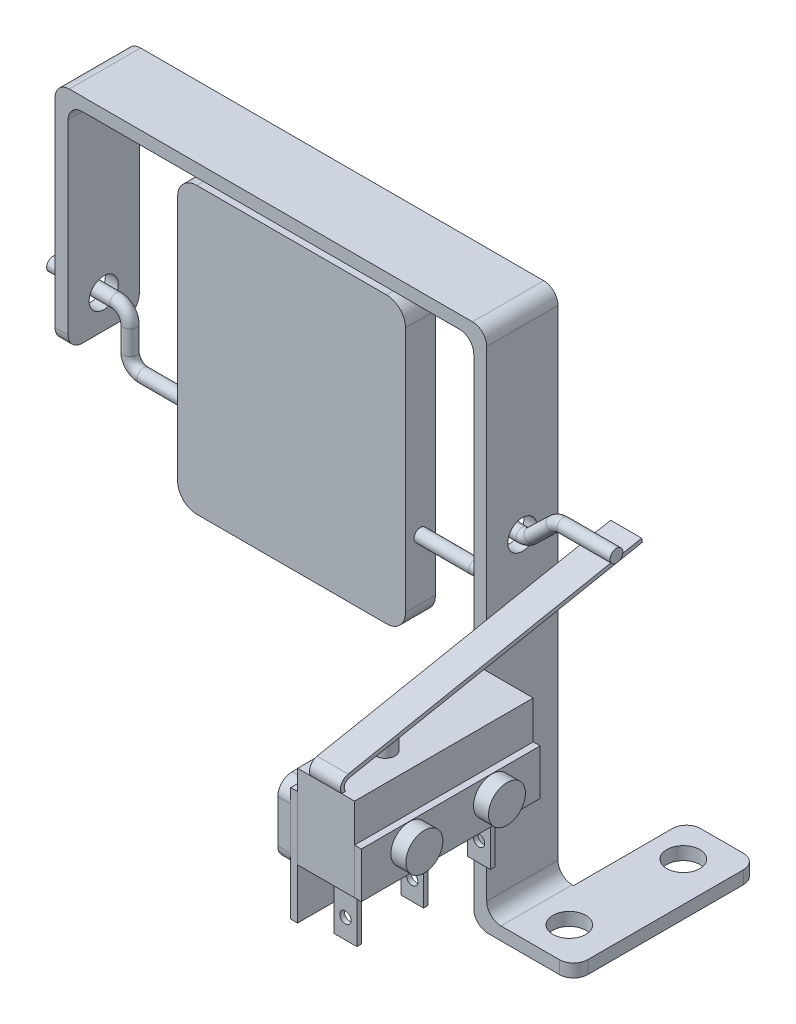
from build123d import *

# Parameters (mm, degrees)
BOSS_EXTRUDE1_DEPTH   = 3.96875
SKETCH2_W             = 7.9375
SKETCH2_H             = 12.5857
BOSS_EXTRUDE2_DEPTH   = 1.4478
SKETCH13_R            = 1.8415
CUT_EXTRUDE3_DEPTH    = 83.644481068
BOSS_EXTRUDE3_DEPTH   = 7.9375
SKETCH12_R            = 1.6256
CUT_EXTRUDE2_DEPTH    = 87.754067418
FILLET1_R             = 1.5875
SKETCH5_W             = 20.828
SKETCH5_H             = 12.7
BOSS_EXTRUDE5_DEPTH   = 0.762
SKETCH4_W             = 19.9136
SKETCH4_H             = 9.3218
BOSS_EXTRUDE4_DEPTH   = 6.35
SKETCH6_W             = 19.9136
SKETCH6_H             = 5.08
BOSS_EXTRUDE6_DEPTH   = 0.762
SKETCH7_R             = 2.06375
BOSS_EXTRUDE7_DEPTH   = 1.6637
SKETCH8_W             = 0.508
SKETCH8_H             = 6.858
BOSS_EXTRUDE8_DEPTH   = 2.54
BOSS_EXTRUDE8_2_DEPTH = 2.54
BOSS_EXTRUDE8_3_DEPTH = 2.54
SKETCH9_R             = 0.635
CUT_EXTRUDE1_DEPTH    = 93.418192325
BOSS_EXTRUDE9_DEPTH   = 1.7272
BOSS_EXTRUDE10_REACH  = 72.944
SKETCH11_R            = 1.0795
SKETCH15_R            = 0.71755
BOSS_EXTRUDE11_DEPTH  = 1.6637


with BuildPart() as part:
    # Sketch1 → Boss-Extrude1 (new, symmetric)
    with BuildSketch(Plane.XY):
        Polygon((0, 0), (-11.1252, 0), (-11.1252, 56.7182), (-56.3372, 56.7182), (-56.3372, 32.766), (-57.785, 32.766), (-57.785, 58.166), (-9.6774, 58.166), (-9.6774, 1.4478), (0, 1.4478), align=None)
    extrude(amount=BOSS_EXTRUDE1_DEPTH, both=True)

    # Sketch2 → Boss-Extrude2 (add)
    with BuildSketch(Plane(origin=(0, 1.4478, 0), x_dir=(1, 0, 0), z_dir=(0, 1, 0))):
        with Locations((-3.96875, 10.2616)):
            Rectangle(SKETCH2_W, SKETCH2_H)
    extrude(amount=-BOSS_EXTRUDE2_DEPTH)

    # Sketch13 → Cut-Extrude3 (cut, through all)
    with BuildSketch(Plane(origin=(0, 1.4478, 0), x_dir=(1, 0, 0), z_dir=(0, 1, 0))):
        with Locations(Location((-4.3815, 12.64285, 0), (0, 0, 270))):
            Circle(SKETCH13_R)
        with Locations(Location((-4.3815, -0.05715, 0), (0, 0, 270))):
            Circle(SKETCH13_R)
    extrude(amount=-CUT_EXTRUDE3_DEPTH, mode=Mode.SUBTRACT)

    # Sketch3 → Boss-Extrude3 (add)
    with BuildSketch(Plane(origin=(0, 19.5326, 0), x_dir=(1, 0, 0), z_dir=(0, 1, 0))):
        Polygon((-9.6774, -3.96875), (-9.6774, -5.1943), (-7.1374, -9.9568), (-7.1374, -28.35275), (-8.5852, -28.35275), (-8.5852, -10.31875), (-11.1252, -5.55625), (-11.1252, -3.96875), align=None)
    extrude(amount=BOSS_EXTRUDE3_DEPTH)

    # Sketch12 → Cut-Extrude2 (cut, through all)
    with BuildSketch(Plane.ZY.offset(57.785)):
        with Locations(Location((0, 36.449, 0), (0, 0, 270))):
            Circle(SKETCH12_R)
    extrude(amount=-CUT_EXTRUDE2_DEPTH, mode=Mode.SUBTRACT)

    # Fillet1
    fillet1_edges = [part.edges().sort_by_distance(p)[0] for p in [
        (-57.0611, 32.766, -3.96875),
        (-11.1252, 0, 0),
        (-11.1252, 56.7182, 0),
        (-56.3372, 56.7182, 0),
        (-57.785, 58.166, 0),
        (-9.6774, 58.166, 0),
        (-9.6774, 1.4478, 0),
        (-57.0611, 32.766, 3.96875),
        (0, 0.7239, -16.55445),
        (-7.9375, 0.7239, -16.55445),
        (0, 0.7239, 3.96875),
        (-7.8613, 19.5326, 28.35275),
        (-7.8613, 27.4701, 28.35275),
    ]]
    fillet(fillet1_edges, radius=FILLET1_R)


with BuildPart() as body_2:
    # Sketch5 → Boss-Extrude5 (new body)
    with BuildSketch(Plane(origin=(-7.1374, 0, 0), x_dir=(0, 0, -1), z_dir=(1, 0, 0))):
        with Locations((-17.93875, 21.1201)):
            Rectangle(SKETCH5_W, SKETCH5_H)
    extrude(amount=BOSS_EXTRUDE5_DEPTH)


with BuildPart() as body_3:
    # Sketch4 → Boss-Extrude4 (new body)
    with BuildSketch(Plane(origin=(-6.3754, 0, 0), x_dir=(0, 0, -1), z_dir=(1, 0, 0))):
        with Locations((-18.39595, 25.0571)):
            Rectangle(SKETCH4_W, SKETCH4_H)
    extrude(amount=BOSS_EXTRUDE4_DEPTH)

    # Boss-Extrude10: up to this plane
    boss_extrude10_end = Plane(origin=(-1.4732, 30.805803118, 27.539516146), z_dir=(0, 0.9813203193458281, 0.19238095238095218))
    # Sketch11 → Boss-Extrude10 (add, up to the surface)
    with BuildSketch(Plane(origin=(0, 29.718, 0), x_dir=(1, 0, 0), z_dir=(0, 1, 0)), mode=Mode.PRIVATE) as boss_extrude10_sk1:
        with Locations(Location((-3.2004, -21.74875, 0), (0, 0, 90))):
            Circle(SKETCH11_R)
    boss_extrude10_tool1 = split(extrude(boss_extrude10_sk1.sketch, amount=BOSS_EXTRUDE10_REACH, mode=Mode.PRIVATE), bisect_by=boss_extrude10_end, keep=Keep.BOTH, mode=Mode.PRIVATE)
    add(boss_extrude10_tool1.solids().sort_by_distance((-3.2004, 29.718, 21.74875))[0])


with BuildPart() as body_4:
    # Sketch6 → Boss-Extrude6 (new body)
    with BuildSketch(Plane(origin=(-0.0254, 0, 0), x_dir=(0, 0, -1), z_dir=(1, 0, 0))):
        with Locations((-18.39595, 22.9362)):
            Rectangle(SKETCH6_W, SKETCH6_H)
    extrude(amount=BOSS_EXTRUDE6_DEPTH)

    # Sketch7 → Boss-Extrude7 (add)
    with BuildSketch(Plane(origin=(0.7366, 0, 0), x_dir=(0, 0, -1), z_dir=(1, 0, 0))):
        with Locations(Location((-22.9997, 23.3807, 0), (0, 0, 180))):
            Circle(SKETCH7_R)
        with Locations(Location((-13.7922, 23.3807, 0), (0, 0, 180))):
            Circle(SKETCH7_R)
    extrude(amount=BOSS_EXTRUDE7_DEPTH)


with BuildPart() as body_5:
    # Sketch8 → Boss-Extrude8 (new body)
    with BuildSketch(Plane(origin=(-2.032, 0, 0), x_dir=(0, 0, -1), z_dir=(1, 0, 0))):
        with Locations((-25.83815, 16.9672)):
            Rectangle(SKETCH8_W, SKETCH8_H)
    extrude(amount=-BOSS_EXTRUDE8_DEPTH)


with BuildPart() as body_6:
    # Sketch8 → Boss-Extrude8 2 (new body)
    with BuildSketch(Plane(origin=(-2.032, 0, 0), x_dir=(0, 0, -1), z_dir=(1, 0, 0))):
        with Locations((-18.39595, 16.9672)):
            Rectangle(SKETCH8_W, SKETCH8_H)
    extrude(amount=-BOSS_EXTRUDE8_2_DEPTH)


with BuildPart() as body_7:
    # Sketch8 → Boss-Extrude8 3 (new body)
    with BuildSketch(Plane(origin=(-2.032, 0, 0), x_dir=(0, 0, -1), z_dir=(1, 0, 0))):
        with Locations((-10.95375, 16.9672)):
            Rectangle(SKETCH8_W, SKETCH8_H)
    extrude(amount=-BOSS_EXTRUDE8_3_DEPTH)


with BuildPart() as cut_extrude1_tool:
    # Sketch9 → Cut-Extrude1 (new, through all)
    with BuildSketch(Plane.XY.offset(26.09215)):
        with Locations(Location((-3.302, 15.7226, 0), (0, 0, 270))):
            Circle(SKETCH9_R)
    extrude(amount=-CUT_EXTRUDE1_DEPTH)


with BuildPart() as body_5_1:
    add(body_5.part)

    # Cut-Extrude1: cut by cut_extrude1_tool
    add(cut_extrude1_tool.part, mode=Mode.SUBTRACT)


with BuildPart() as body_6_1:
    add(body_6.part)

    # Cut-Extrude1: cut by cut_extrude1_tool
    add(cut_extrude1_tool.part, mode=Mode.SUBTRACT)


with BuildPart() as body_7_1:
    add(body_7.part)

    # Cut-Extrude1: cut by cut_extrude1_tool
    add(cut_extrude1_tool.part, mode=Mode.SUBTRACT)


with BuildPart() as body_8:
    # Sketch10 → Boss-Extrude9 (new, symmetric)
    with BuildSketch(Plane(origin=(-3.2004, 0, 0), x_dir=(0, 0, -1), z_dir=(1, 0, 0))):
        with BuildLine():
            Line((-27.539516146, 30.805803118), (5.17525, 37.219303118))
            Line((5.17525, 37.219303118), (5.089736667, 37.6555))
            Line((5.089736667, 37.6555), (-27.62502948, 31.242))
            ThreePointArc((-27.62502948, 31.242), (-28.371997816, 30.662936751), (-28.35275, 29.718))
            Line((-28.35275, 29.718), (-27.90825, 29.718))
            ThreePointArc((-27.90825, 29.718), (-28.0190051, 30.361939407), (-27.539516146, 30.805803118))
        make_face()
    extrude(amount=BOSS_EXTRUDE9_DEPTH, both=True)


with BuildPart() as body_9:
    # Sweep1: sweep along a curve in space
    with BuildLine() as sweep1_path:
        Line((-61.976, 36.449, 0), (-54.9402, 36.449, 0))
        ThreePointArc((-54.9402, 36.449, 0), (-53.862569265, 36.002630735, 0), (-53.4162, 34.925, 0))
        Line((-53.4162, 34.925, 0), (-53.4162, 32.258, 0))
        ThreePointArc((-53.4162, 32.258, 0), (-52.969830735, 31.180369265, 0), (-51.8922, 30.734, 0))
        Line((-51.8922, 30.734, 0), (-46.4312, 30.734, 0))
        Line((-46.4312, 30.734, 0), (-21.0312, 30.734, 0))
        Line((-21.0312, 30.734, 0), (-14.9352, 30.734, 0))
        ThreePointArc((-14.9352, 30.734, 0), (-13.857569265, 31.180369265, 0), (-13.4112, 32.258, 0))
        Line((-13.4112, 32.258, 0), (-13.4112, 34.925, 0))
        ThreePointArc((-13.4112, 34.925, 0), (-12.964830735, 36.002630735, 0), (-11.8872, 36.449, 0))
        Line((-11.8872, 36.449, 0), (-9.6774, 36.449, 0))
        ThreePointArc((-9.6774, 36.449, 0), (-9.108659643, 36.559100991, 0), (-8.622096291, 36.873495529, 0))
        Line((-8.622096291, 36.873495529, 0), (-6.1722, 39.224904471, 0))
        ThreePointArc((-6.1722, 39.224904471, 0), (-5.685636647, 39.539299009, 0), (-5.116896291, 39.6494, 0))
        Line((-5.116896291, 39.6494, 0), (0.8128, 39.6494, 0))
    # Sketch15 → Sweep1 (sweep)
    with BuildSketch(Plane.ZY.offset(61.976)):
        with Locations((0, 36.449)):
            Circle(SKETCH15_R)
    sweep(path=sweep1_path.line)

    # Sketch16 → Boss-Extrude11 (add, symmetric)
    with BuildSketch(Plane.XY):
        with BuildLine():
            Line((-46.4312, 51.5366), (-46.4312, 24.0538))
            ThreePointArc((-46.4312, 24.0538), (-45.806283028, 22.545116972), (-44.2976, 21.9202))
            Line((-44.2976, 21.9202), (-23.1648, 21.9202))
            ThreePointArc((-23.1648, 21.9202), (-21.656116972, 22.545116972), (-21.0312, 24.0538))
            Line((-21.0312, 24.0538), (-21.0312, 51.5366))
            ThreePointArc((-21.0312, 51.5366), (-21.656116972, 53.045283028), (-23.1648, 53.6702))
            Line((-23.1648, 53.6702), (-44.2976, 53.6702))
            ThreePointArc((-44.2976, 53.6702), (-45.806283028, 53.045283028), (-46.4312, 51.5366))
        make_face()
    extrude(amount=BOSS_EXTRUDE11_DEPTH, both=True)


solid = Compound([part.part, body_2.part, body_3.part, body_4.part, body_5_1.part, body_6_1.part, body_7_1.part, body_8.part, body_9.part])
